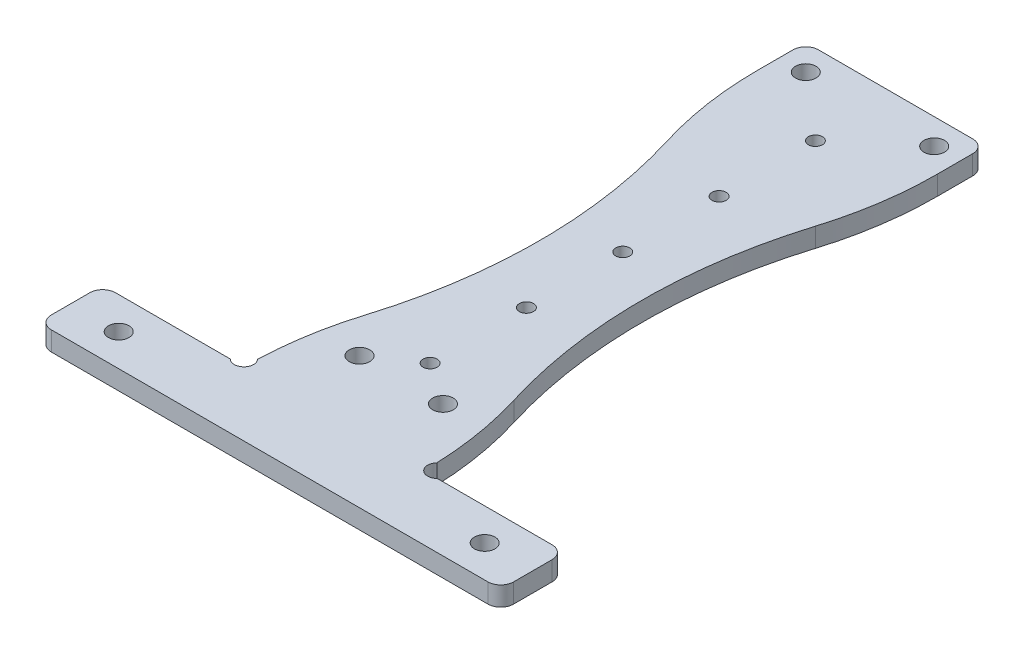
from build123d import *

# Parameters (mm, degrees)
SKETCH_1_R      = 1.6
SKETCH_1_R_2    = 1.1
EXTRUDE_1_DEPTH = 3
FILLET_1_R      = 2


with BuildPart() as part:
    # 草图1 → 凸台-拉伸1 (new body)
    with BuildSketch(Plane(origin=(0, 0, 0), x_dir=(1, 0, 0), z_dir=(0, 1, 0))):
        with BuildLine():
            Line((-36, 10), (-36, 0))
            Line((-36, 0), (36, 0))
            Line((36, 0), (36, 10))
            Line((36, 10), (16.121320344, 10))
            ThreePointArc((16.121320344, 10), (15.060660172, 9.560660172), (14, 10))
            ThreePointArc((14, 10), (13.560916248, 11.032944403), (13.961534907, 12.081406787))
            ThreePointArc((13.961534907, 12.081406787), (13.212832412, 19.384450727), (11.520782396, 26.528117359))
            ThreePointArc((11.520782396, 26.528117359), (8, 50), (11.520782396, 73.471882641))
            ThreePointArc((11.520782396, 73.471882641), (13.376747878, 81.643487818), (14, 90))
            Line((14, 90), (14, 97.5))
            Line((14, 97.5), (-14, 97.5))
            Line((-14, 97.5), (-14, 90))
            ThreePointArc((-14, 90), (-13.376747878, 81.643487818), (-11.520782396, 73.471882641))
            ThreePointArc((-11.520782396, 73.471882641), (-8, 50), (-11.520782396, 26.528117359))
            ThreePointArc((-11.520782396, 26.528117359), (-13.212832412, 19.384450727), (-13.961534907, 12.081406787))
            ThreePointArc((-13.961534907, 12.081406787), (-13.664471091, 11.608981293), (-13.560660172, 11.060660172))
            ThreePointArc((-13.560660172, 11.060660172), (-13.674840873, 10.486635023), (-14, 10))
            ThreePointArc((-14, 10), (-15.060660172, 9.560660172), (-16.121320344, 10))
            Line((-16.121320344, 10), (-36, 10))
        make_face()
        with Locations(Location((-28.5, 5, 0), (0, 0, 270))):
            Circle(SKETCH_1_R, mode=Mode.SUBTRACT)
        with Locations(Location((-6.5, 20.5, 0), (0, 0, 270))):
            Circle(SKETCH_1_R, mode=Mode.SUBTRACT)
        with Locations(Location((6.5, 20.5, 0), (0, 0, 270))):
            Circle(SKETCH_1_R, mode=Mode.SUBTRACT)
        with Locations(Location((28.5, 5, 0), (0, 0, 270))):
            Circle(SKETCH_1_R, mode=Mode.SUBTRACT)
        with Locations(Location((0, 25, 0), (0, 0, 270))):
            Circle(SKETCH_1_R_2, mode=Mode.SUBTRACT)
        with Locations(Location((0, 40, 0), (0, 0, 270))):
            Circle(SKETCH_1_R_2, mode=Mode.SUBTRACT)
        with Locations(Location((-10, 93.5, 0), (0, 0, 270))):
            Circle(SKETCH_1_R, mode=Mode.SUBTRACT)
        with Locations(Location((0, 55, 0), (0, 0, 270))):
            Circle(SKETCH_1_R_2, mode=Mode.SUBTRACT)
        with Locations(Location((0, 70, 0), (0, 0, 270))):
            Circle(SKETCH_1_R_2, mode=Mode.SUBTRACT)
        with Locations(Location((0, 85, 0), (0, 0, 270))):
            Circle(SKETCH_1_R_2, mode=Mode.SUBTRACT)
        with Locations(Location((10, 93.5, 0), (0, 0, 270))):
            Circle(SKETCH_1_R, mode=Mode.SUBTRACT)
    extrude(amount=EXTRUDE_1_DEPTH)

    # 圆角1
    fillet_1_edges = [part.edges().sort_by_distance(p)[0] for p in [
        (36, 1.5, -10),
        (36, 1.5, 0),
        (-36, 1.5, 0),
        (-36, 1.5, -10),
        (-14, 1.5, -97.5),
        (14, 1.5, -97.5),
    ]]
    fillet(fillet_1_edges, radius=FILLET_1_R)


solid = part.part
